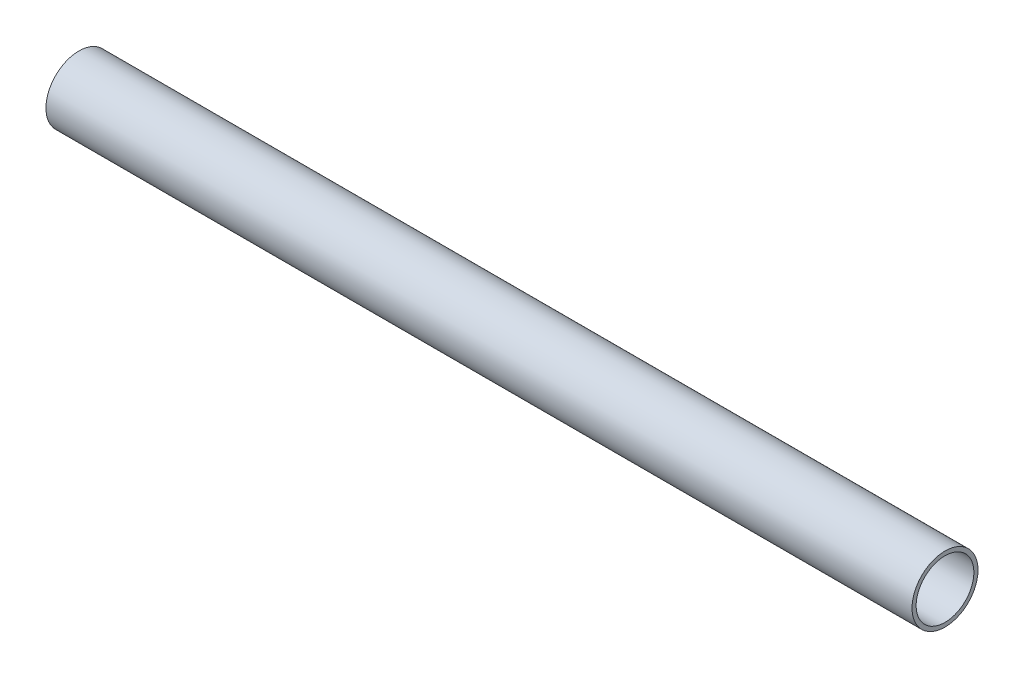
from build123d import *

# Parameters (mm, degrees)
IZIM1_R                     = 8
IZIM1_R_2                   = 7
Y_KSEKLIK_EKSTR_ZYON1_DEPTH = 210


with BuildPart() as part:
    # Çizim1 → Yükseklik-Ekstrüzyon1 (new body)
    with BuildSketch(Plane(origin=(0, 0, 0), x_dir=(0, 0, -1), z_dir=(1, 0, 0))):
        Circle(IZIM1_R)
        Circle(IZIM1_R_2, mode=Mode.SUBTRACT)
    extrude(amount=Y_KSEKLIK_EKSTR_ZYON1_DEPTH)


solid = part.part
